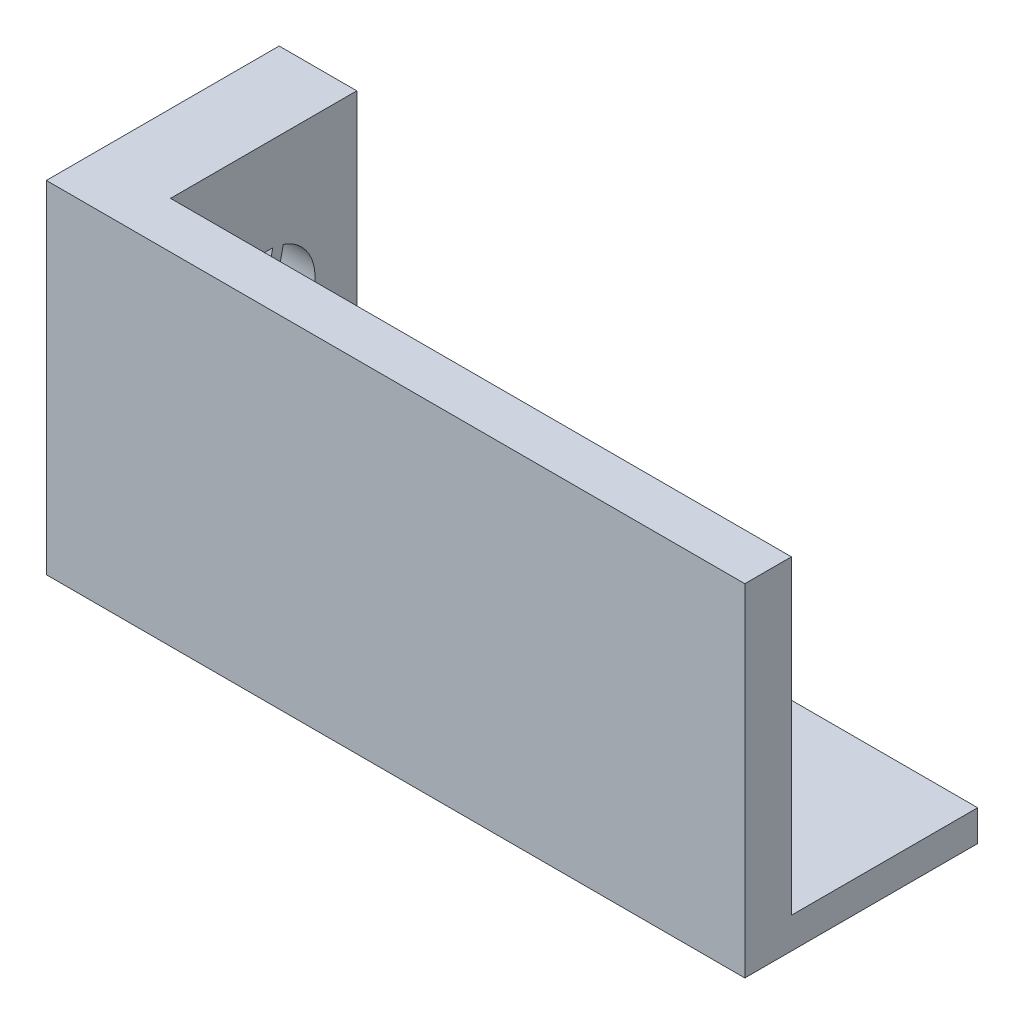
from build123d import *

# Parameters (mm, degrees)
ESQUISSE1_W             = 45
ESQUISSE1_H             = 20
BOSS_EXTRU_1_DEPTH      = 3
ESQUISSE2_W             = 15
ESQUISSE2_H             = 20
BOSS_EXTRU_2_DEPTH      = 5
ESQUISSE3_W             = 45
ESQUISSE3_H             = 15
BOSS_EXTRU_3_DEPTH      = 2
ENL_V_MAT_EXTRU_1_REACH = 46.348
ESQUISSE4_R             = 3
BOSS_EXTRU_4_DEPTH      = 5


with BuildPart() as part:
    # Esquisse1 → Boss.-Extru.1 (new body)
    with BuildSketch(Plane.XY):
        with Locations((1.348933413, 4.924242424)):
            Rectangle(ESQUISSE1_W, ESQUISSE1_H)
    extrude(amount=BOSS_EXTRU_1_DEPTH)

    # Esquisse2 → Boss.-Extru.2 (add)
    with BuildSketch(Plane.ZY.offset(21.151066587)):
        with Locations((-4.5, 4.924242424)):
            Rectangle(ESQUISSE2_W, ESQUISSE2_H)
    extrude(amount=-BOSS_EXTRU_2_DEPTH)

    # Esquisse3 → Boss.-Extru.3 (add)
    with BuildSketch(Plane.XZ.offset(5.075757576)):
        with Locations((1.348933413, -4.5)):
            Rectangle(ESQUISSE3_W, ESQUISSE3_H)
    extrude(amount=BOSS_EXTRU_3_DEPTH)

    # Esquisse4 → Enlèv. mat.-Extru.1 (cut, up to next)
    with BuildSketch(Plane(origin=(-16.151066587, 0, 0), x_dir=(0, 0, -1), z_dir=(1, 0, 0)), mode=Mode.PRIVATE) as enl_v_mat_extru_1_sk1:
        with Locations(Location((6.311557668, 5.877767498, 0), (0, 0, 90))):
            Circle(ESQUISSE4_R)
    enl_v_mat_extru_1_tool1 = extrude(enl_v_mat_extru_1_sk1.sketch, amount=-ENL_V_MAT_EXTRU_1_REACH, mode=Mode.PRIVATE) & part.part
    add(enl_v_mat_extru_1_tool1.solids().sort_by_distance((-16.151067, 5.877767, -6.311558))[0], mode=Mode.SUBTRACT)

    # Esquisse5 → Boss.-Extru.4 (add)
    with BuildSketch(Plane(origin=(-16.151066587, 0, 0), x_dir=(0, 0, -1), z_dir=(1, 0, 0))):
        Polygon((6.61719562, 9.041849495), (5.191621887, 2.399624229), (5.877852712, 2.252343371), (7.335036292, 9.041849495), align=None)
    extrude(amount=-BOSS_EXTRU_4_DEPTH)


solid = part.part
